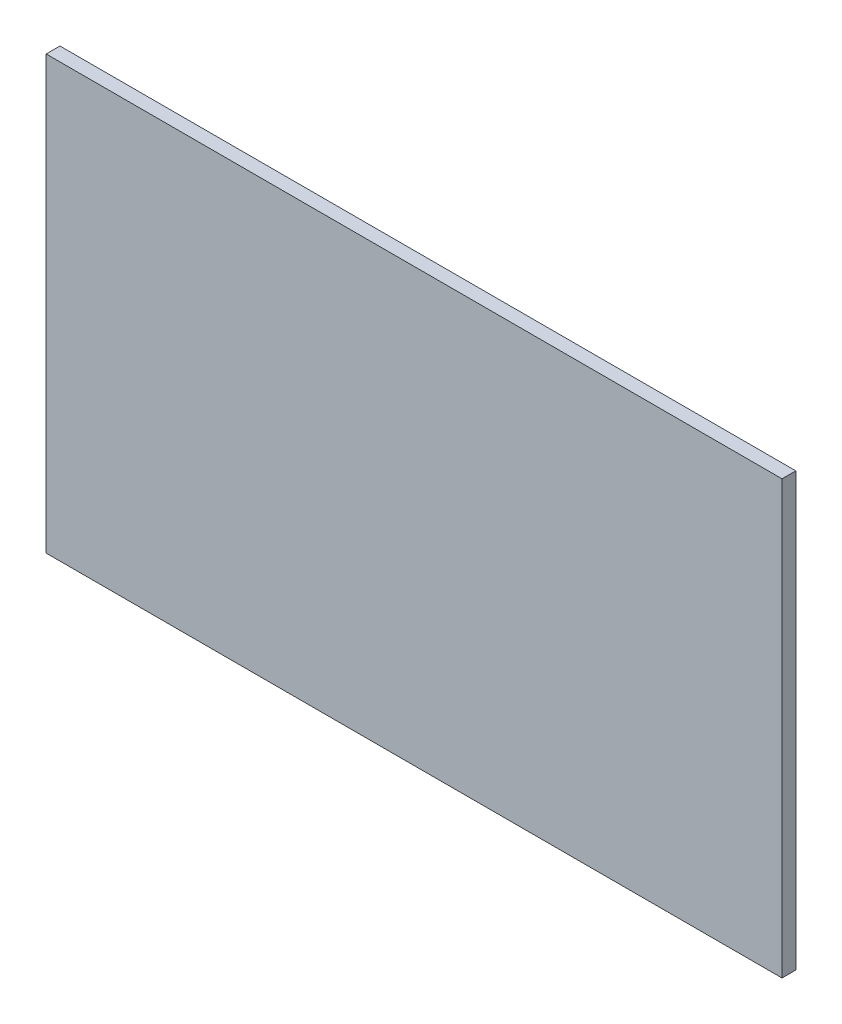
from build123d import *

# Parameters (mm, degrees)
SKETCH1_W           = 160
SKETCH1_H           = 94
BOSS_EXTRUDE1_DEPTH = 1.5


with BuildPart() as part:
    # Sketch1 → Boss-Extrude1 (new, symmetric)
    with BuildSketch(Plane.XY):
        with Locations((0, -47)):
            Rectangle(SKETCH1_W, SKETCH1_H)
    extrude(amount=BOSS_EXTRUDE1_DEPTH, both=True)


solid = part.part
